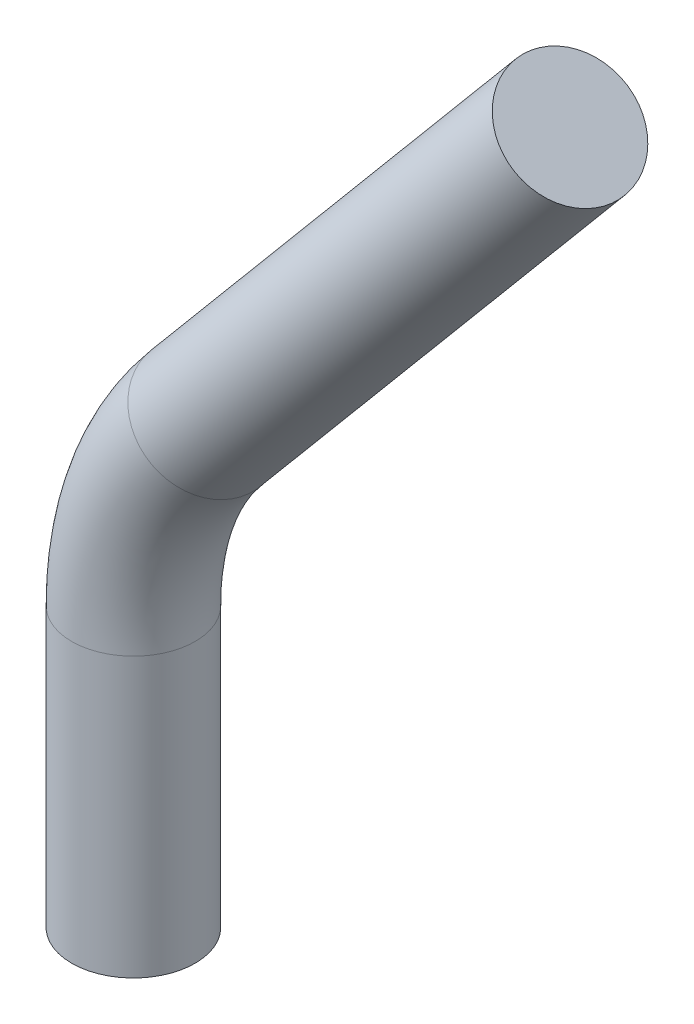
from build123d import *

# Parameters (mm, degrees)
SKETCH2_R = 3


with BuildPart() as part:
    # Sweep1: sweep along a path in Sketch1
    with BuildLine(Plane.XY) as sweep1_path:
        Line((0, 0), (0, 13.540446486))
        ThreePointArc((0, 13.540446486), (0.904610688, 18.670748636), (3.509333353, 23.182260631))
        Line((3.509333353, 23.182260631), (21.21199112, 44.279466623))
    # Sketch2 → Sweep1 (sweep)
    with BuildSketch(Plane(origin=(0, 0, 0), x_dir=(1, 0, 0), z_dir=(0, 1, 0))):
        Circle(SKETCH2_R)
    sweep(path=sweep1_path.line)


solid = part.part
